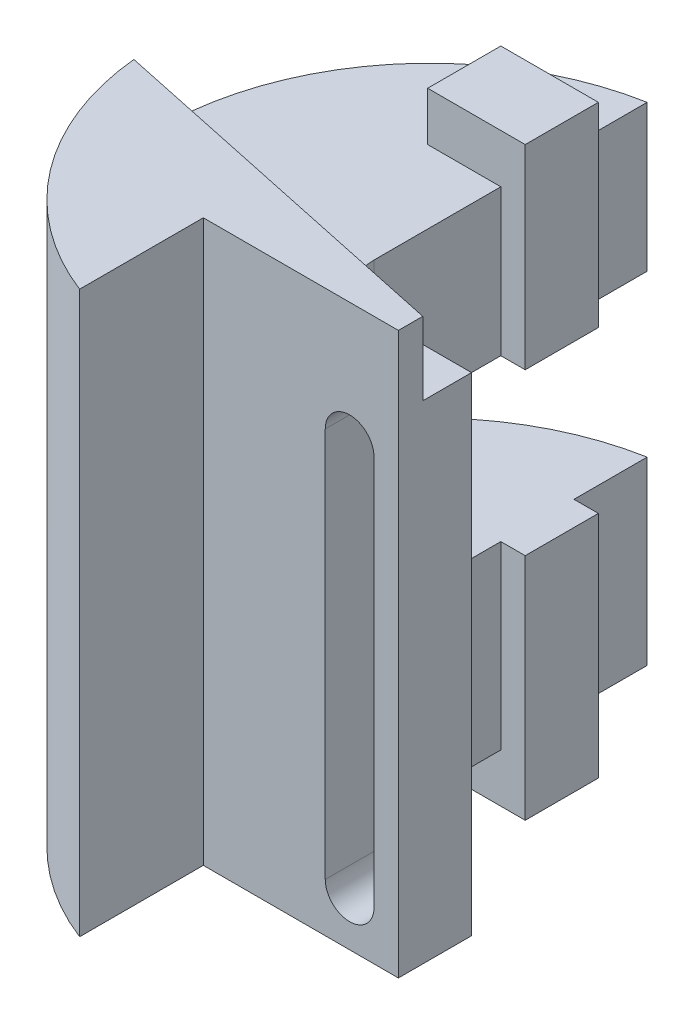
from build123d import *

# Parameters (mm, degrees)
BOSS_EXTRUDE1_DEPTH      = 115
CUT_EXTRUDE1_START       = -15
CUT_EXTRUDE1_DEPTH       = 15
BOSS_EXTRUDE2_DEPTH      = 10
BOSS_EXTRUDE2_DEPTH_BACK = 110
SKETCH3_W                = 20
SKETCH3_H                = 15
SKETCH4_W                = 40
SKETCH4_H                = 33
CUT_EXTRUDE2_DEPTH       = 160.644135501
CUT_EXTRUDE3_DEPTH       = 153.581945197


with BuildPart() as part:
    # Sketch1 → Boss-Extrude1 (new body)
    with BuildSketch(Plane(origin=(0, 0, 0), x_dir=(1, 0, 0), z_dir=(0, 1, 0))):
        with BuildLine():
            Line((0, 0), (-40, 0))
            Line((-40, 0), (-40, -25.362796982))
            ThreePointArc((-40, -25.362796982), (-75.256322222, 31.603413808), (-30, 81))
            Line((-30, 81), (-30, 25))
            ThreePointArc((-30, 25), (-27.071067812, 17.928932188), (-20, 15))
            Line((-20, 15), (0, 15))
            Line((0, 15), (0, 0))
        make_face()
    extrude(amount=BOSS_EXTRUDE1_DEPTH)

    # Sketch2 → Cut-Extrude1 (cut)
    with BuildSketch(Plane(origin=(0, 115, 0), x_dir=(1, 0, 0), z_dir=(0, 1, 0)).offset(CUT_EXTRUDE1_START)):
        with BuildLine():
            Line((0, 5), (-75.235044142, 20.9917023))
            ThreePointArc((-75.235044142, 20.9917023), (-64.318751046, 59.816391467), (-30, 81))
            Line((-30, 81), (-30, 25))
            ThreePointArc((-30, 25), (-27.071067812, 17.928932188), (-20, 15))
            Line((-20, 15), (0, 15))
            Line((0, 15), (0, 5))
        make_face()
    extrude(amount=CUT_EXTRUDE1_DEPTH, mode=Mode.SUBTRACT)

    # Sketch3 → Boss-Extrude2 (add, two sides: drawn at the far end of the back side and taken through both)
    with BuildSketch(Plane(origin=(0, 100, 0), x_dir=(1, 0, 0), z_dir=(0, 1, 0)).offset(-BOSS_EXTRUDE2_DEPTH_BACK)):
        with Locations((-35, 58.5)):
            Rectangle(SKETCH3_W, SKETCH3_H)
    extrude(amount=BOSS_EXTRUDE2_DEPTH + BOSS_EXTRUDE2_DEPTH_BACK)

    # Sketch4 → Cut-Extrude2 (cut, through all)
    with BuildSketch(Plane(origin=(0, 0, 0), x_dir=(0, 0, -1), z_dir=(1, 0, 0))):
        with Locations((61, 53.5)):
            Rectangle(SKETCH4_W, SKETCH4_H)
    extrude(amount=-CUT_EXTRUDE2_DEPTH, mode=Mode.SUBTRACT)

    # Sketch5 → Cut-Extrude3 (cut, through all)
    with BuildSketch(Plane(origin=(0, 0, -15), x_dir=(-1, 0, 0), z_dir=(0, 0, -1))):
        with BuildLine():
            Line((15, 90), (15, 10))
            ThreePointArc((15, 10), (10, 5), (5, 10))
            Line((5, 10), (5, 90))
            ThreePointArc((5, 90), (10, 95), (15, 90))
        make_face()
    extrude(amount=-CUT_EXTRUDE3_DEPTH, mode=Mode.SUBTRACT)


solid = part.part
